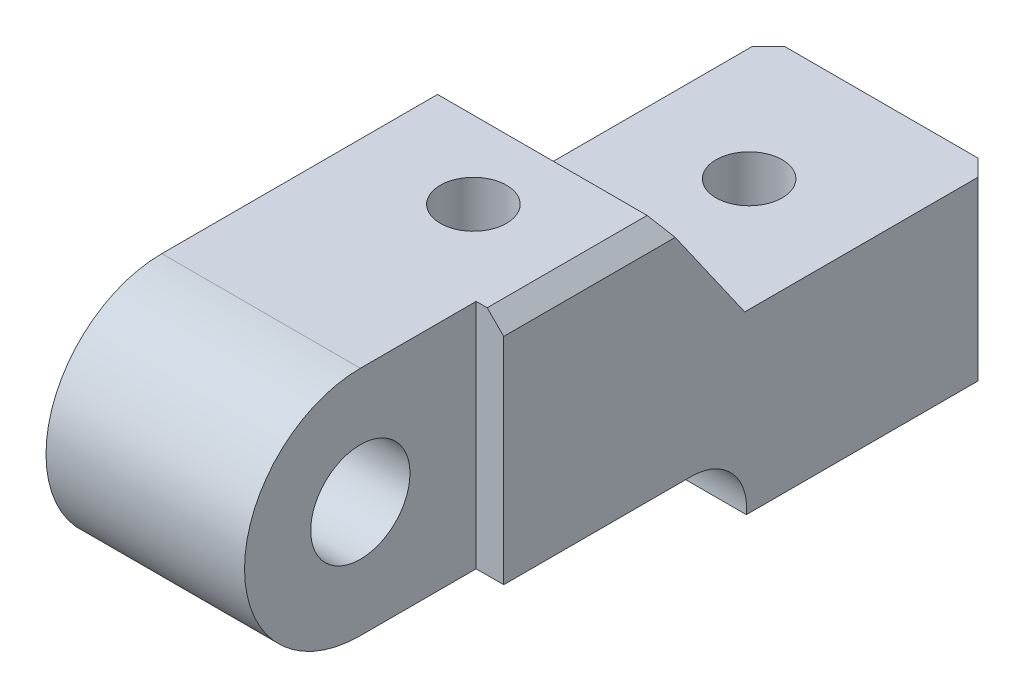
from build123d import *

# Parameters (mm, degrees)
SKETCH2_R           = 9
BOSS_EXTRUDE1_DEPTH = 20.5
SKETCH3_W           = 5
SKETCH3_H           = 21
CUT_EXTRUDE1_DEPTH  = 124.81134843
SKETCH4_W           = 12
SKETCH4_H           = 7
CUT_EXTRUDE2_DEPTH  = 137.401063046
CHAMFER2_SIZE       = 3


with BuildPart() as part:
    # Sketch2 → Boss-Extrude1 (new, symmetric)
    with BuildSketch(Plane(origin=(0, 0, 0), x_dir=(0, 0, -1), z_dir=(1, 0, 0))):
        with BuildLine():
            Line((0, 21), (50, 21))
            Line((50, 21), (64.704358302, 0))
            Line((64.704358302, 0), (110, 0))
            Line((110, 0), (110, -32))
            Line((110, -32), (65, -32))
            ThreePointArc((65, -32), (62.466324116, -24.291796068), (55.050125629, -21))
            Line((55.050125629, -21), (0, -21))
            ThreePointArc((0, -21), (-21, 0), (0, 21))
        make_face()
        Circle(SKETCH2_R, mode=Mode.SUBTRACT)
    extrude(amount=BOSS_EXTRUDE1_DEPTH, both=True)

    # Sketch3 → Cut-Extrude1 (cut, through all)
    with BuildSketch(Plane(origin=(0, 21, 0), x_dir=(1, 0, 0), z_dir=(0, 1, 0))):
        with Locations((18, -10.5)):
            Rectangle(SKETCH3_W, SKETCH3_H)
        with Locations((18, 10.5)):
            Rectangle(SKETCH3_W, SKETCH3_H)
        with BuildLine():
            ThreePointArc((0, 42), (-6, 36), (0, 30))
            Line((0, 30), (0, 42))
        make_face()
        with BuildLine():
            Line((0, 42), (0, 30))
            ThreePointArc((0, 30), (4.242640687, 31.757359313), (6, 36))
            ThreePointArc((6, 36), (4.242640687, 40.242640687), (0, 42))
        make_face()
        with BuildLine():
            ThreePointArc((6, 86), (4.242640687, 90.242640687), (0, 92))
            Line((0, 92), (0, 80))
            ThreePointArc((0, 80), (4.242640687, 81.757359313), (6, 86))
        make_face()
        with BuildLine():
            Line((0, 80), (0, 92))
            ThreePointArc((0, 92), (-6, 86), (0, 80))
        make_face()
    extrude(amount=-CUT_EXTRUDE1_DEPTH, mode=Mode.SUBTRACT)

    # Sketch4 → Cut-Extrude2 (cut, through all)
    with BuildSketch(Plane(origin=(0, 0, -110), x_dir=(-1, 0, 0), z_dir=(0, 0, -1))):
        with Locations((0, -28.5)):
            Rectangle(SKETCH4_W, SKETCH4_H)
    extrude(amount=-CUT_EXTRUDE2_DEPTH, mode=Mode.SUBTRACT)

    # Chamfer2
    chamfer2_edges = [part.edges().sort_by_distance(p)[0] for p in [
        (20.5, -16, -110),
        (20.5, 21, -35.5),
        (-20.5, -16, -110),
    ]]
    chamfer(chamfer2_edges, length=CHAMFER2_SIZE)


solid = part.part
